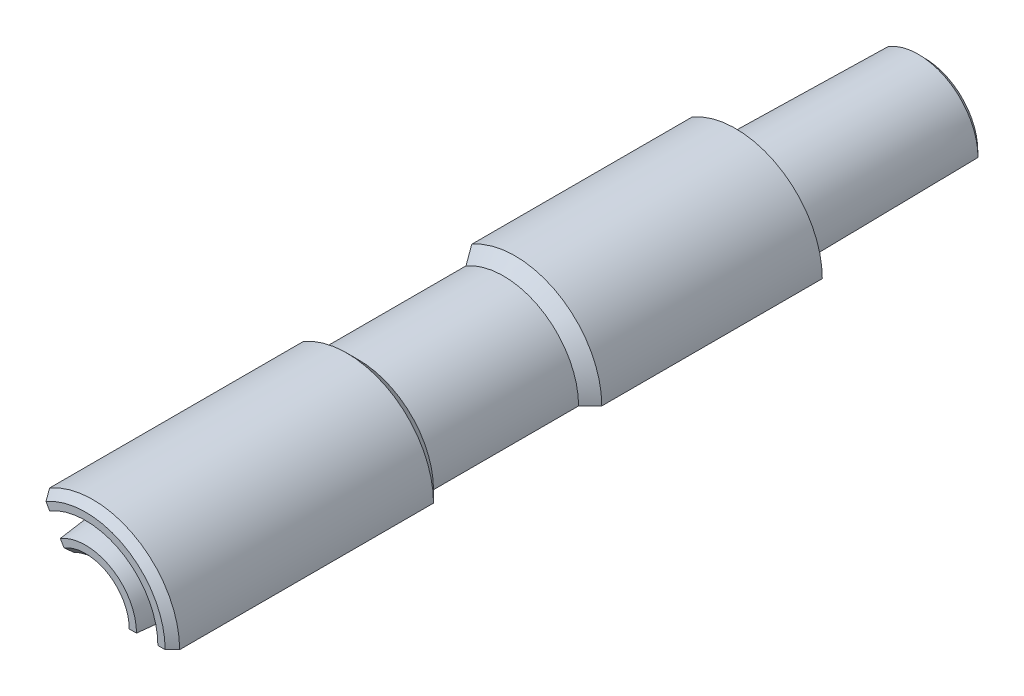
from build123d import *

# Parameters (mm, degrees)
REVOLVE_1_ANGLE = 120
CHAMFER_1_SIZE  = 0.4
CHAMFER_1_SIZE2 = 0.407145225
CHAMFER_2_SIZE  = 0.5


with BuildPart() as part:
    # 스케치1 → 회전1 (revolve)
    with BuildSketch(Plane(origin=(0, 0, 0), x_dir=(1, 0, 0), z_dir=(0, 1, 0))):
        Polygon((2.525, -30.375), (2.525, -38.375), (3, -38.85), (3, -48.85), (2.525, -49.325), (2.525, -57.325), (3, -57.8), (3.5, -57.8), (3.960399052, -53.8), (4.644221552, -53.8), (4.975, -57.8), (5.975, -57.8), (5.975, -39.8), (5.175, -39), (5.175, -29), (5.975, -28.2), (5.975, -13), (5.475, -13), (5.175, -19), (4.430616082, -19), (4.1, 0), (3, 0), (3, -10.95), (2.525, -11.425), (2.525, -19.425), (3, -19.9), (3, -29.9), align=None)
    revolve(axis=Axis((0, 0, 0), (0, 0, 1)), revolution_arc=REVOLVE_1_ANGLE)

    # 모따기1
    chamfer_1_edges = [part.edges().sort_by_distance(p)[0] for p in [
        (2.05, 3.550704156, 0),
    ]]
    chamfer_1_side = [part.faces().sort_by_distance(p)[0] for p in [
        (2.132654021, 3.693865118, 9.5),
    ]]
    chamfer(chamfer_1_edges, length=CHAMFER_1_SIZE, length2=CHAMFER_1_SIZE2, reference=chamfer_1_side[0])

    # 모따기2
    chamfer_2_edges = [part.edges().sort_by_distance(p)[0] for p in [
        (2.9875, 5.174501788, 57.8),
    ]]
    chamfer(chamfer_2_edges, length=CHAMFER_2_SIZE)


solid = part.part
